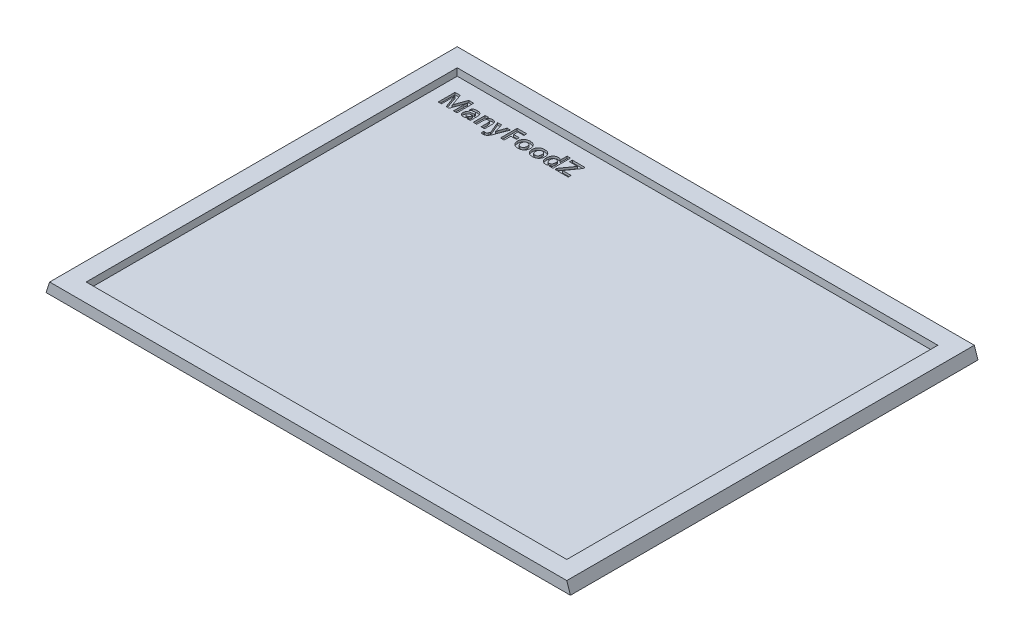
from build123d import *

# Parameters (mm, degrees)
SKETCH1_W           = 143.6
SKETCH1_H           = 111.6
BOSS_EXTRUDE1_DEPTH = 3
CUT_EXTRUDE1_REACH  = 134.736
SKETCH3_W           = 131.6
SKETCH3_H           = 101.6
CUT_EXTRUDE2_DEPTH  = 2
CUT_EXTRUDE3_DEPTH  = 0.6


with BuildPart() as part:
    # Sketch1 → Boss-Extrude1 (new body)
    with BuildSketch(Plane(origin=(0, 0, 0), x_dir=(1, 0, 0), z_dir=(0, 1, 0))):
        Rectangle(SKETCH1_W, SKETCH1_H)
    extrude(amount=BOSS_EXTRUDE1_DEPTH)

    # Sketch2 → Cut-Extrude1 (cut, up to next)
    with BuildSketch(Plane.XY.offset(55.8), mode=Mode.PRIVATE) as cut_extrude1_sk1:
        Polygon((71.8, 0), (70.8, 3), (71.8, 3), align=None)
    cut_extrude1_tool1 = extrude(cut_extrude1_sk1.sketch, amount=-CUT_EXTRUDE1_REACH, mode=Mode.PRIVATE) & part.part
    # Sketch2 → Cut-Extrude1 (cut, up to next)
    with BuildSketch(Plane.XY.offset(55.8), mode=Mode.PRIVATE) as cut_extrude1_sk2:
        Polygon((-71.8, 3), (-71.8, 0), (-70.8, 3), align=None)
    cut_extrude1_tool2 = extrude(cut_extrude1_sk2.sketch, amount=-CUT_EXTRUDE1_REACH, mode=Mode.PRIVATE) & part.part
    add(cut_extrude1_tool1.solids().sort_by_distance((71.466667, 2, 55.8))[0], mode=Mode.SUBTRACT)
    add(cut_extrude1_tool2.solids().sort_by_distance((-71.466667, 2, 55.8))[0], mode=Mode.SUBTRACT)

    # Sketch3 → Cut-Extrude2 (cut)
    with BuildSketch(Plane(origin=(0, 3, 0), x_dir=(1, 0, 0), z_dir=(0, 1, 0))):
        Rectangle(SKETCH3_W, SKETCH3_H)
    extrude(amount=-CUT_EXTRUDE2_DEPTH, mode=Mode.SUBTRACT)

    # Sketch4 → Cut-Extrude3 (cut)
    # profile 1 of 9: a face of its own
    with BuildSketch(Plane(origin=(0, 1, 0), x_dir=(1, 0, 0), z_dir=(0, 1, 0))):
        with BuildLine():
            Line((-58.092627806, 42.07925622), (-58.092627806, 44.857391199))
            add(Edge.make_bspline(
                [(-58.092627806, 44.857391199), (-58.092600808, 44.89058489), (-58.092545367, 44.958748281), (-58.087288699, 45.064112925), (-58.081600875, 45.175656275), (-58.072758527, 45.293579437), (-58.061013133, 45.417538842), (-58.048523348, 45.547808867), (-58.031287835, 45.6839239), (-58.019287266, 45.776744036), (-58.013152709, 45.824192651)],
                knots=[0, 0, 0, 0, 0.820532149, 1.684966374, 2.607606779, 3.581914253, 4.608215301, 5.686044516, 6.81713186, 8, 8, 8, 8], degree=3))
            Line((-58.013152709, 45.824192651), (-58.036733233, 45.824192651))
            add(Edge.make_bspline(
                [(-58.036733233, 45.824192651), (-58.043897275, 45.788943129), (-58.057589414, 45.72157315), (-58.079007763, 45.625373343), (-58.097743072, 45.538154483), (-58.116251169, 45.460165447), (-58.13350413, 45.391099306), (-58.150263696, 45.331251861), (-58.164547911, 45.280311099), (-58.175171819, 45.250066318), (-58.179963077, 45.236426276)],
                knots=[0, 0, 0, 0, 1.426064356, 2.725538406, 3.907327566, 4.962762773, 5.903337351, 6.72936823, 7.426959974, 8, 8, 8, 8], degree=3))
            Line((-58.179963077, 45.236426276), (-59.322308425, 42.07925622))
            Line((-59.322308425, 42.07925622), (-60.104832455, 42.07925622))
            Line((-60.104832455, 42.07925622), (-61.246304451, 45.206732283))
            add(Edge.make_bspline(
                [(-61.246304451, 45.206732283), (-61.250192875, 45.218053211), (-61.259291303, 45.244542771), (-61.271995084, 45.290989588), (-61.286678805, 45.349909508), (-61.304350755, 45.420766106), (-61.322306298, 45.504543051), (-61.343090724, 45.600064875), (-61.367341194, 45.707805353), (-61.382438043, 45.783980105), (-61.390407648, 45.824192651)],
                knots=[0, 0, 0, 0, 0.452786508, 1.059464042, 1.820794487, 2.75042866, 3.822030313, 5.062086147, 6.449079346, 8, 8, 8, 8], degree=3))
            Line((-61.390407648, 45.824192651), (-61.41660823, 45.824192651))
            add(Edge.make_bspline(
                [(-61.41660823, 45.824192651), (-61.408748126, 45.631790347), (-61.393020348, 45.246800442), (-61.391278828, 44.861493306), (-61.390407648, 44.668747013)],
                knots=[0, 0, 0, 0, 0.999518694, 2, 2, 2, 2], degree=3))
            Line((-61.390407648, 44.668747013), (-61.390407648, 42.07925622))
            Line((-61.390407648, 42.07925622), (-62.284720826, 42.07925622))
            Line((-62.284720826, 42.07925622), (-62.284720826, 46.662611255))
            Line((-62.284720826, 46.662611255), (-60.831461912, 46.662611255))
            Line((-60.831461912, 46.662611255), (-59.852433522, 43.892336451))
            add(Edge.make_bspline(
                [(-59.852433522, 43.892336451), (-59.833028262, 43.836015975), (-59.795162297, 43.726116429), (-59.747673013, 43.562179473), (-59.710561947, 43.403272643), (-59.693226196, 43.298270215), (-59.684749801, 43.246928797)],
                knots=[0, 0, 0, 0, 1.070175583, 2.088260221, 3.065246074, 4, 4, 4, 4], degree=3))
            Line((-59.684749801, 43.246928797), (-59.664662688, 43.246928797))
            add(Edge.make_bspline(
                [(-59.664662688, 43.246928797), (-59.64954193, 43.30756333), (-59.620235285, 43.42508354), (-59.572719001, 43.594078858), (-59.526394476, 43.751211602), (-59.49182232, 43.850536736), (-59.47514515, 43.89844992)],
                knots=[0, 0, 0, 0, 1.1046679, 2.14103741, 3.103260037, 4, 4, 4, 4], degree=3))
            Line((-59.47514515, 43.89844992), (-58.483889821, 46.662611255))
            Line((-58.483889821, 46.662611255), (-57.142420055, 46.662611255))
            Line((-57.142420055, 46.662611255), (-57.142420055, 42.07925622))
            Line((-57.142420055, 42.07925622), (-58.092627806, 42.07925622))
        make_face()
    # profile 2 of 9: a face of its own
    with BuildSketch(Plane(origin=(0, 1, 0), x_dir=(1, 0, 0), z_dir=(0, 1, 0))):
        with BuildLine():
            add(Edge.make_bspline(
                [(-56.080423157, 45.101056605), (-56.041156996, 45.121265776), (-55.958266798, 45.163926993), (-55.820129731, 45.216565001), (-55.663564561, 45.261920532), (-55.493993244, 45.301353594), (-55.322457493, 45.334885974), (-55.158572618, 45.35803224), (-55.008285788, 45.374606646), (-54.912207464, 45.376252461), (-54.866462886, 45.377036062)],
                knots=[0, 0, 0, 0, 0.844161796, 1.782011202, 2.821464139, 3.959991635, 5.110977224, 6.163000581, 7.125372316, 8, 8, 8, 8], degree=3))
            add(Edge.make_bspline(
                [(-54.866462886, 45.377036062), (-54.811690529, 45.376103465), (-54.705400683, 45.37429369), (-54.551257978, 45.358258984), (-54.407283822, 45.332802179), (-54.274399131, 45.295014982), (-54.151446067, 45.247950064), (-54.039267591, 45.189620624), (-53.938196346, 45.119612989), (-53.846138463, 45.041139812), (-53.766337486, 44.950297568), (-53.697692341, 44.848467103), (-53.639440373, 44.736449203), (-53.590905641, 44.614263782), (-53.554880212, 44.481097206), (-53.52771726, 44.338093841), (-53.512083861, 44.184091805), (-53.51023046, 44.078104874), (-53.509272771, 44.023339358)],
                knots=[0, 0, 0, 0, 1.195033485, 2.319051647, 3.37828662, 4.38189099, 5.329303812, 6.247200064, 7.133620009, 8.0074276, 8.88063446, 9.763472527, 10.681368779, 11.631100749, 12.62687191, 13.687268524, 14.804966515, 16, 16, 16, 16], degree=3))
            Line((-53.509272771, 44.023339358), (-53.509272771, 42.07925622))
            Line((-53.509272771, 42.07925622), (-54.403585949, 42.07925622))
            Line((-54.403585949, 42.07925622), (-54.403585949, 42.542133158))
            Line((-54.403585949, 42.542133158), (-54.415812887, 42.542133158))
            add(Edge.make_bspline(
                [(-54.415812887, 42.542133158), (-54.444232926, 42.500905148), (-54.499924932, 42.420114599), (-54.59874306, 42.31393815), (-54.706913904, 42.223376154), (-54.825944123, 42.15088617), (-54.954052707, 42.093221904), (-55.091792401, 42.052528959), (-55.239331887, 42.027297754), (-55.34087941, 42.024698281), (-55.393094572, 42.023361647)],
                knots=[0, 0, 0, 0, 1.036379796, 2.030893378, 2.994715684, 3.950597048, 4.909063114, 5.897577251, 6.918946122, 8, 8, 8, 8], degree=3))
            add(Edge.make_bspline(
                [(-55.393094572, 42.023361647), (-55.430962635, 42.024327175), (-55.504832652, 42.026210652), (-55.612743766, 42.037173232), (-55.714654217, 42.057538457), (-55.810898011, 42.08529207), (-55.901816759, 42.121124038), (-55.986286528, 42.166005032), (-56.065922187, 42.217481098), (-56.138183185, 42.278017614), (-56.203476357, 42.34498321), (-56.261108786, 42.417698035), (-56.30823188, 42.497407467), (-56.347728486, 42.582157087), (-56.378322235, 42.672680308), (-56.400111337, 42.768647002), (-56.413448885, 42.870429068), (-56.414996839, 42.940340382), (-56.415790598, 42.976189456)],
                knots=[0, 0, 0, 0, 1.151241264, 2.245750264, 3.292235834, 4.305995761, 5.287015962, 6.256796608, 7.20909936, 8.164234827, 9.11542683, 10.048331367, 10.977113757, 11.923353321, 12.886001939, 13.875605435, 14.910654483, 16, 16, 16, 16], degree=3))
            add(Edge.make_bspline(
                [(-56.415790598, 42.976189456), (-56.414988054, 43.013199465), (-56.41342189, 43.085424424), (-56.400182566, 43.190711703), (-56.378054593, 43.289959388), (-56.348908167, 43.384004329), (-56.309565829, 43.471688001), (-56.260332826, 43.552575378), (-56.205161534, 43.629379066), (-56.138722126, 43.698173007), (-56.064685286, 43.761538175), (-55.982579721, 43.81951746), (-55.89074672, 43.869907456), (-55.790845087, 43.915257892), (-55.682499707, 43.95572884), (-55.564916129, 43.988423097), (-55.43886786, 44.015525571), (-55.351547559, 44.028759279), (-55.306632654, 44.035566296)],
                knots=[0, 0, 0, 0, 1.040433833, 2.030404586, 2.977796283, 3.896860488, 4.794531022, 5.671967209, 6.556098576, 7.447814657, 8.353474551, 9.293695121, 10.268488436, 11.294197642, 12.376862801, 13.517047719, 14.72284492, 16, 16, 16, 16], degree=3))
            Line((-55.306632654, 44.035566296), (-54.41668624, 44.153468912))
            add(Edge.make_bspline(
                [(-54.41668624, 44.153468912), (-54.417977839, 44.196739106), (-54.420426708, 44.278779215), (-54.4488933, 44.393198948), (-54.494146714, 44.491451526), (-54.559860782, 44.571814028), (-54.644576866, 44.633263295), (-54.747388229, 44.67602432), (-54.867506968, 44.702091025), (-54.953654229, 44.704844844), (-54.999212499, 44.706301179)],
                knots=[0, 0, 0, 0, 1.126537193, 2.135909854, 3.053075826, 3.927259428, 4.812815909, 5.755167073, 6.812838579, 8, 8, 8, 8], degree=3))
            add(Edge.make_bspline(
                [(-54.999212499, 44.706301179), (-55.046707563, 44.705298191), (-55.141375261, 44.703299023), (-55.282107703, 44.687062025), (-55.42077666, 44.660856193), (-55.557373976, 44.62396012), (-55.692033053, 44.576862574), (-55.824329723, 44.518627725), (-55.954870936, 44.450952692), (-56.038299841, 44.397780445), (-56.080423157, 44.370933738)],
                knots=[0, 0, 0, 0, 0.992177821, 1.977620056, 2.955883283, 3.938599532, 4.931280679, 5.933698501, 6.95672286, 8, 8, 8, 8], degree=3))
            Line((-56.080423157, 44.370933738), (-56.080423157, 45.101056605))
        make_face()
        with BuildLine():
            add(Edge.make_bspline(
                [(-55.018426258, 43.532515134), (-55.057939782, 43.526547953), (-55.132729657, 43.515253473), (-55.235849992, 43.48360345), (-55.32376629, 43.442897179), (-55.396611299, 43.391876191), (-55.453057852, 43.329450382), (-55.493159757, 43.256863751), (-55.517559041, 43.174227546), (-55.520134816, 43.115808865), (-55.521477421, 43.085358545)],
                knots=[0, 0, 0, 0, 1.281690516, 2.425940907, 3.45032824, 4.381560374, 5.261858999, 6.127999084, 7.024232899, 8, 8, 8, 8], degree=3))
            add(Edge.make_bspline(
                [(-55.521477421, 43.085358545), (-55.52003301, 43.057241466), (-55.517242707, 43.002925105), (-55.4936953, 42.925553547), (-55.45476442, 42.857036051), (-55.400199866, 42.798890491), (-55.333659586, 42.751288855), (-55.254603301, 42.71803681), (-55.16557158, 42.697879734), (-55.102671533, 42.69539103), (-55.069954068, 42.69409653)],
                knots=[0, 0, 0, 0, 1.002064714, 1.935780994, 2.857447314, 3.791452732, 4.76036446, 5.756537646, 6.833062882, 8, 8, 8, 8], degree=3))
            add(Edge.make_bspline(
                [(-55.069954068, 42.69409653), (-55.04664463, 42.69490499), (-55.001028225, 42.696487141), (-54.934153799, 42.70484532), (-54.870739427, 42.720963687), (-54.810178183, 42.742888303), (-54.752510309, 42.770515283), (-54.698639331, 42.805309538), (-54.647851475, 42.845771202), (-54.599888017, 42.891476021), (-54.557676267, 42.943072132), (-54.519999301, 42.997378735), (-54.486937732, 43.054135334), (-54.461918279, 43.115215373), (-54.442023848, 43.178677814), (-54.426786693, 43.244879943), (-54.417939265, 43.314224362), (-54.417109734, 43.361603663), (-54.41668624, 43.385791878)],
                knots=[0, 0, 0, 0, 1.051845881, 2.058454922, 3.033033584, 3.996758545, 4.959946562, 5.910701175, 6.882799539, 7.885804649, 8.892927484, 9.883737812, 10.865895372, 11.848754975, 12.853821056, 13.863679714, 14.909359733, 16, 16, 16, 16], degree=3))
            Line((-54.41668624, 43.385791878), (-54.41668624, 43.610243525))
            Line((-54.41668624, 43.610243525), (-55.018426258, 43.532515134))
        make_face(mode=Mode.SUBTRACT)
    # profile 3 of 9: a face of its own
    with BuildSketch(Plane(origin=(0, 1, 0), x_dir=(1, 0, 0), z_dir=(0, 1, 0))):
        with BuildLine():
            Line((-49.59665262, 42.07925622), (-50.546860371, 42.07925622))
            Line((-50.546860371, 42.07925622), (-50.546860371, 43.871375986))
            add(Edge.make_bspline(
                [(-50.546860371, 43.871375986), (-50.546989091, 43.902837255), (-50.547238546, 43.963807729), (-50.555023777, 44.052041955), (-50.564507844, 44.134512257), (-50.580844029, 44.210451167), (-50.599447388, 44.281166164), (-50.623972642, 44.34530131), (-50.651914718, 44.403676048), (-50.684144541, 44.456031038), (-50.722366864, 44.501217382), (-50.763005696, 44.542141702), (-50.809216564, 44.575568513), (-50.859814835, 44.602820845), (-50.914479477, 44.624864852), (-50.973963683, 44.639118682), (-51.037027608, 44.649534515), (-51.08072289, 44.6501105), (-51.103186049, 44.650406606)],
                knots=[0, 0, 0, 0, 1.385577933, 2.685185481, 3.900730131, 5.040333697, 6.104607026, 7.119499225, 8.0603568, 8.953669725, 9.819198624, 10.662777709, 11.488914802, 12.321203114, 13.190620345, 14.077277699, 15.011554236, 16, 16, 16, 16], degree=3))
            add(Edge.make_bspline(
                [(-51.103186049, 44.650406606), (-51.124765353, 44.649683641), (-51.167553397, 44.648250126), (-51.230185721, 44.638430084), (-51.290171914, 44.623045173), (-51.346921957, 44.599716097), (-51.400957735, 44.569906316), (-51.452665726, 44.534126284), (-51.501177424, 44.491560349), (-51.546283432, 44.442995342), (-51.586620829, 44.389080358), (-51.623421214, 44.332119588), (-51.652453429, 44.270305776), (-51.678314883, 44.205864489), (-51.69754863, 44.137339828), (-51.70997105, 44.065297383), (-51.719539989, 43.990112245), (-51.720272807, 43.938656802), (-51.720646416, 43.912423564)],
                knots=[0, 0, 0, 0, 0.962967614, 1.90939895, 2.82343066, 3.721059163, 4.639881235, 5.573469571, 6.522039335, 7.515047549, 8.526002385, 9.52460601, 10.535811341, 11.568577159, 12.621661098, 13.704858409, 14.829880903, 16, 16, 16, 16], degree=3))
            Line((-51.720646416, 43.912423564), (-51.720646416, 42.07925622))
            Line((-51.720646416, 42.07925622), (-52.670854167, 42.07925622))
            Line((-52.670854167, 42.07925622), (-52.670854167, 45.321141489))
            Line((-52.670854167, 45.321141489), (-51.720646416, 45.321141489))
            Line((-51.720646416, 45.321141489), (-51.720646416, 44.783156218))
            Line((-51.720646416, 44.783156218), (-51.709292831, 44.783156218))
            add(Edge.make_bspline(
                [(-51.709292831, 44.783156218), (-51.679212792, 44.83019799), (-51.620413468, 44.922153468), (-51.516164183, 45.044376476), (-51.400117823, 45.146744765), (-51.27468758, 45.231939042), (-51.137596604, 45.296312604), (-50.99125042, 45.344685635), (-50.833698106, 45.371248477), (-50.725407842, 45.375077178), (-50.670003103, 45.377036062)],
                knots=[0, 0, 0, 0, 1.064617132, 2.081073364, 3.053068974, 4.009833717, 4.963950105, 5.933641332, 6.942785272, 8, 8, 8, 8], degree=3))
            add(Edge.make_bspline(
                [(-50.670003103, 45.377036062), (-50.626567106, 45.376134558), (-50.542305026, 45.374385716), (-50.420226407, 45.357895967), (-50.30597008, 45.333634745), (-50.200792543, 45.296328765), (-50.103237355, 45.25015092), (-50.014938519, 45.192056122), (-49.934493803, 45.124114222), (-49.862466017, 45.045899915), (-49.799215003, 44.956931623), (-49.745444938, 44.857446543), (-49.69847758, 44.748346413), (-49.661840764, 44.628365327), (-49.631731505, 44.498295573), (-49.611400958, 44.357785834), (-49.599171659, 44.20696222), (-49.597510157, 44.103129993), (-49.59665262, 44.04953994)],
                knots=[0, 0, 0, 0, 1.067420533, 2.070703575, 3.024128503, 3.934192378, 4.808213066, 5.671854353, 6.525140104, 7.391387901, 8.279251406, 9.20186848, 10.167150257, 11.194978914, 12.281972813, 13.447160288, 14.682424336, 16, 16, 16, 16], degree=3))
            Line((-49.59665262, 44.04953994), (-49.59665262, 42.07925622))
        make_face()
    # profile 4 of 9: a face of its own
    with BuildSketch(Plane(origin=(0, 1, 0), x_dir=(1, 0, 0), z_dir=(0, 1, 0))):
        with BuildLine():
            Line((-45.725953398, 45.321141489), (-47.081396808, 41.798036647))
            add(Edge.make_bspline(
                [(-47.081396808, 41.798036647), (-47.101284046, 41.748337913), (-47.140285976, 41.650871052), (-47.205736686, 41.511582437), (-47.274872584, 41.381902347), (-47.347119783, 41.261619134), (-47.424447198, 41.15149768), (-47.504207105, 41.049942534), (-47.588426017, 40.958641899), (-47.676260651, 40.877221935), (-47.766781458, 40.803815158), (-47.862848326, 40.74218176), (-47.96129042, 40.688047853), (-48.064417208, 40.64571972), (-48.17039119, 40.610633987), (-48.280950326, 40.588060567), (-48.394740571, 40.572021192), (-48.472006956, 40.570747002), (-48.511075198, 40.570102733)],
                knots=[0, 0, 0, 0, 1.274545313, 2.499579345, 3.662627125, 4.773100961, 5.838560291, 6.864961619, 7.846165112, 8.792891985, 9.715346361, 10.61717241, 11.507412726, 12.386789422, 13.268131451, 14.161470608, 15.070383442, 16, 16, 16, 16], degree=3))
            add(Edge.make_bspline(
                [(-48.511075198, 40.570102733), (-48.570203258, 40.571152388), (-48.681653887, 40.573130885), (-48.838207359, 40.586385827), (-48.974209078, 40.609618015), (-49.055669503, 40.63509462), (-49.093601457, 40.646957772)],
                knots=[0, 0, 0, 0, 1.202193107, 2.266016832, 3.192572723, 4, 4, 4, 4], degree=3))
            Line((-49.093601457, 40.646957772), (-49.093601457, 41.408521337))
            add(Edge.make_bspline(
                [(-49.093601457, 41.408521337), (-49.060541177, 41.391260222), (-48.994787384, 41.356929483), (-48.888415681, 41.322399992), (-48.77747965, 41.300539057), (-48.701571861, 41.298013995), (-48.66303857, 41.29673219)],
                knots=[0, 0, 0, 0, 0.993652693, 1.976281932, 2.972694144, 4, 4, 4, 4], degree=3))
            add(Edge.make_bspline(
                [(-48.66303857, 41.29673219), (-48.630930682, 41.297882951), (-48.56883014, 41.300108663), (-48.479648555, 41.317873966), (-48.397663996, 41.346959895), (-48.322662659, 41.38811245), (-48.255989494, 41.442259501), (-48.19650807, 41.507225744), (-48.144430949, 41.584045459), (-48.117289358, 41.641576894), (-48.103219482, 41.671400504)],
                knots=[0, 0, 0, 0, 1.071610233, 2.072623892, 3.022870821, 3.967180676, 4.914638322, 5.877975009, 6.899967548, 8, 8, 8, 8], degree=3))
            Line((-48.103219482, 41.671400504), (-47.919815412, 42.094976569))
            Line((-47.919815412, 42.094976569), (-49.261285178, 45.321141489))
            Line((-49.261285178, 45.321141489), (-48.187934695, 45.321141489))
            Line((-48.187934695, 45.321141489), (-47.539906982, 43.301950018))
            add(Edge.make_bspline(
                [(-47.539906982, 43.301950018), (-47.530240343, 43.27031551), (-47.510604678, 43.206056924), (-47.487161969, 43.105704305), (-47.468102532, 43.000121051), (-47.45839893, 42.92761603), (-47.453445064, 42.89060089)],
                knots=[0, 0, 0, 0, 0.942726539, 1.914942855, 2.935540168, 4, 4, 4, 4], degree=3))
            Line((-47.453445064, 42.89060089), (-47.435104657, 42.89060089))
            add(Edge.make_bspline(
                [(-47.435104657, 42.89060089), (-47.430697659, 42.918301958), (-47.421140312, 42.978376569), (-47.40012034, 43.073775094), (-47.370330535, 43.180846709), (-47.348169139, 43.255986183), (-47.3364158, 43.295836549)],
                knots=[0, 0, 0, 0, 0.806124642, 1.748222305, 2.805765358, 4, 4, 4, 4], degree=3))
            Line((-47.3364158, 43.295836549), (-46.676161149, 45.321141489))
            Line((-46.676161149, 45.321141489), (-45.725953398, 45.321141489))
        make_face()
    # profile 5 of 9: a face of its own
    with BuildSketch(Plane(origin=(0, 1, 0), x_dir=(1, 0, 0), z_dir=(0, 1, 0))):
        Polygon((-42.609830921, 45.880087225), (-44.255227431, 45.880087225), (-44.255227431, 44.706301179), (-42.721620068, 44.706301179), (-42.721620068, 43.923777149), (-44.230773555, 43.923777149), (-44.230773555, 42.07925622), (-45.236875879, 42.07925622), (-45.236875879, 46.662611255), (-42.609830921, 46.662611255), align=None)
    # profile 6 of 9: a face of its own
    with BuildSketch(Plane(origin=(0, 1, 0), x_dir=(1, 0, 0), z_dir=(0, 1, 0))):
        with BuildLine():
            add(Edge.make_bspline(
                [(-42.162674332, 43.685351858), (-42.161176627, 43.749467351), (-42.158253083, 43.874621817), (-42.135180895, 44.056756898), (-42.097849251, 44.228550625), (-42.044976357, 44.389912018), (-41.974842487, 44.540075501), (-41.892298953, 44.680982636), (-41.792465619, 44.81028157), (-41.677954912, 44.927708297), (-41.551350758, 45.033558137), (-41.413409783, 45.125698904), (-41.264750139, 45.203900864), (-41.105765178, 45.26747439), (-40.936247338, 45.316310396), (-40.756965135, 45.352196754), (-40.566687004, 45.373198764), (-40.436399624, 45.375736515), (-40.369681213, 45.377036062)],
                knots=[0, 0, 0, 0, 1.103453058, 2.15395801, 3.154678934, 4.126148344, 5.070148626, 6.002678962, 6.931877209, 7.874599583, 8.821044363, 9.767595283, 10.724805658, 11.707533345, 12.709834137, 13.757538153, 14.851665509, 16, 16, 16, 16], degree=3))
            add(Edge.make_bspline(
                [(-40.369681213, 45.377036062), (-40.304986352, 45.375798365), (-40.178735242, 45.373383015), (-39.994830587, 45.351572277), (-39.820856934, 45.318612327), (-39.657748306, 45.268818157), (-39.503765981, 45.207515457), (-39.36108191, 45.129849771), (-39.228052046, 45.039704089), (-39.106981626, 44.935528491), (-38.997330794, 44.820302), (-38.902064498, 44.694191623), (-38.820898476, 44.558761538), (-38.755209292, 44.41328102), (-38.703686226, 44.258463673), (-38.667195718, 44.094017375), (-38.644890453, 43.920318948), (-38.642526089, 43.801285134), (-38.641316195, 43.740373079)],
                knots=[0, 0, 0, 0, 1.154217571, 2.252439331, 3.300975582, 4.310246632, 5.291497618, 6.253956641, 7.203666926, 8.154399993, 9.098965462, 10.037337181, 10.969401587, 11.911118977, 12.880523217, 13.876343809, 14.913281367, 16, 16, 16, 16], degree=3))
            add(Edge.make_bspline(
                [(-38.641316195, 43.740373079), (-38.6429256, 43.676560996), (-38.646073274, 43.551757283), (-38.667720835, 43.369500221), (-38.705388407, 43.197277771), (-38.757894879, 43.034869843), (-38.824932518, 42.881867337), (-38.9086862, 42.740022455), (-39.006227482, 42.607533472), (-39.118949533, 42.48683302), (-39.243508405, 42.377416429), (-39.380136701, 42.282421337), (-39.527179172, 42.202101557), (-39.684838824, 42.135943262), (-39.853084989, 42.085928215), (-40.031533503, 42.049033619), (-40.220654754, 42.026968965), (-40.350407973, 42.02458318), (-40.41684226, 42.023361647)],
                knots=[0, 0, 0, 0, 1.09727435, 2.146049842, 3.15059286, 4.124223328, 5.076775921, 6.016934818, 6.951103508, 7.900454057, 8.851281785, 9.797022045, 10.755907445, 11.727489397, 12.731570765, 13.76934414, 14.857893218, 16, 16, 16, 16], degree=3))
            add(Edge.make_bspline(
                [(-40.41684226, 42.023361647), (-40.482111899, 42.024631728), (-40.609509561, 42.027110756), (-40.795306125, 42.048489575), (-40.970732745, 42.083031758), (-41.135993003, 42.132084188), (-41.290784087, 42.194867536), (-41.435693361, 42.271316308), (-41.569734425, 42.362554965), (-41.69286717, 42.467499701), (-41.803780421, 42.583920936), (-41.899731167, 42.711986442), (-41.98128729, 42.84954936), (-42.048066033, 42.997444856), (-42.099574468, 43.15534764), (-42.135711521, 43.323354631), (-42.159388286, 43.500982311), (-42.161562558, 43.622973799), (-42.162674332, 43.685351858)],
                knots=[0, 0, 0, 0, 1.149013187, 2.242721024, 3.288275975, 4.293858527, 5.273402544, 6.22507903, 7.173436187, 8.122568892, 9.068984397, 9.998887601, 10.934313246, 11.879547946, 12.850577541, 13.85308481, 14.902215176, 16, 16, 16, 16], degree=3))
        make_face()
        with BuildLine():
            add(Edge.make_bspline(
                [(-41.212466581, 43.697578796), (-41.211781325, 43.659419036), (-41.210450394, 43.585303646), (-41.20060775, 43.477682386), (-41.185563456, 43.37709009), (-41.162664057, 43.284269928), (-41.13412742, 43.198624895), (-41.097987363, 43.120685238), (-41.056387667, 43.049248567), (-41.00710469, 42.986044299), (-40.951492036, 42.930519779), (-40.889772007, 42.881934094), (-40.821454986, 42.840764048), (-40.746453431, 42.8077531), (-40.665535409, 42.781086068), (-40.577851351, 42.763493759), (-40.483837917, 42.751537568), (-40.418920822, 42.750517701), (-40.385401562, 42.749991103)],
                knots=[0, 0, 0, 0, 1.270888468, 2.468369665, 3.597092737, 4.655434961, 5.64897887, 6.599178008, 7.512182997, 8.396678124, 9.260629555, 10.123873252, 11.006932034, 11.909787606, 12.848136796, 13.838979758, 14.884179917, 16, 16, 16, 16], degree=3))
            add(Edge.make_bspline(
                [(-40.385401562, 42.749991103), (-40.353342739, 42.750553558), (-40.291047031, 42.751646502), (-40.200660158, 42.76320229), (-40.116295463, 42.78218075), (-40.038403278, 42.809250864), (-39.966518841, 42.843679051), (-39.901005905, 42.88548689), (-39.841317308, 42.935284716), (-39.788577689, 42.99280497), (-39.741275387, 43.057621688), (-39.701360595, 43.130601601), (-39.667470909, 43.211167318), (-39.639607635, 43.298893872), (-39.617775982, 43.394105105), (-39.602173831, 43.496845338), (-39.593851305, 43.607486681), (-39.592316682, 43.683592351), (-39.591523946, 43.722906025)],
                knots=[0, 0, 0, 0, 1.070965572, 2.081066958, 3.039323393, 3.956285232, 4.830977526, 5.697350879, 6.546953418, 7.421375102, 8.299092527, 9.222381685, 10.194613687, 11.216177451, 12.294761889, 13.456137845, 14.68592486, 16, 16, 16, 16], degree=3))
            add(Edge.make_bspline(
                [(-39.591523946, 43.722906025), (-39.592318116, 43.76047304), (-39.593853253, 43.833090399), (-39.602124732, 43.938517243), (-39.617956572, 44.036569368), (-39.639518031, 44.127468653), (-39.667217051, 44.211390474), (-39.702603153, 44.287358667), (-39.742548889, 44.357360996), (-39.789853126, 44.419577188), (-39.843773575, 44.474168371), (-39.903299699, 44.521902372), (-39.96989192, 44.561018764), (-40.041762057, 44.594878479), (-40.12053756, 44.619844738), (-40.205510731, 44.636837995), (-40.296270992, 44.648861305), (-40.359158894, 44.649881639), (-40.391515031, 44.650406606)],
                knots=[0, 0, 0, 0, 1.285280532, 2.484458215, 3.614137234, 4.679338145, 5.677637889, 6.631225331, 7.541609585, 8.429939353, 9.296111078, 10.160850403, 11.031874669, 11.931905529, 12.873562193, 13.850117319, 14.893874718, 16, 16, 16, 16], degree=3))
            add(Edge.make_bspline(
                [(-40.391515031, 44.650406606), (-40.423005079, 44.649940382), (-40.484493991, 44.649030012), (-40.573852052, 44.63598039), (-40.658234392, 44.617240443), (-40.73718765, 44.590284294), (-40.810518337, 44.554699094), (-40.878896942, 44.512183361), (-40.941379013, 44.46079945), (-40.998173275, 44.402180099), (-41.048929658, 44.336601155), (-41.092765304, 44.264082021), (-41.130603743, 44.185634345), (-41.159831935, 44.100084935), (-41.183460244, 44.008706309), (-41.201127392, 43.910974439), (-41.210306126, 43.806343097), (-41.211731866, 43.734566711), (-41.212466581, 43.697578796)],
                knots=[0, 0, 0, 0, 1.057503077, 2.064929068, 3.028638446, 3.96006429, 4.861611523, 5.762946329, 6.660021997, 7.573438799, 8.50115664, 9.440922936, 10.416923198, 11.42268461, 12.474058499, 13.587313027, 14.756690526, 16, 16, 16, 16], degree=3))
        make_face(mode=Mode.SUBTRACT)
    # profile 7 of 9: a face of its own
    with BuildSketch(Plane(origin=(0, 1, 0), x_dir=(1, 0, 0), z_dir=(0, 1, 0))):
        with BuildLine():
            add(Edge.make_bspline(
                [(-38.194159607, 43.685351858), (-38.192661902, 43.749467351), (-38.189738358, 43.874621817), (-38.16666617, 44.056756898), (-38.129334526, 44.228550625), (-38.076461631, 44.389912018), (-38.006327762, 44.540075501), (-37.923784228, 44.680982636), (-37.823950894, 44.81028157), (-37.709440187, 44.927708297), (-37.582836032, 45.033558137), (-37.444895058, 45.125698904), (-37.296235414, 45.203900864), (-37.137250453, 45.26747439), (-36.967732613, 45.316310396), (-36.78845041, 45.352196754), (-36.598172278, 45.373198764), (-36.467884899, 45.375736515), (-36.401166488, 45.377036062)],
                knots=[0, 0, 0, 0, 1.103453058, 2.15395801, 3.154678934, 4.126148344, 5.070148626, 6.002678962, 6.931877209, 7.874599583, 8.821044363, 9.767595283, 10.724805658, 11.707533345, 12.709834137, 13.757538153, 14.851665509, 16, 16, 16, 16], degree=3))
            add(Edge.make_bspline(
                [(-36.401166488, 45.377036062), (-36.336471627, 45.375798365), (-36.210220517, 45.373383015), (-36.026315862, 45.351572277), (-35.852342208, 45.318612327), (-35.689233581, 45.268818157), (-35.535251256, 45.207515457), (-35.392567185, 45.129849771), (-35.259537321, 45.039704089), (-35.138466901, 44.935528491), (-35.028816069, 44.820302), (-34.933549773, 44.694191623), (-34.852383751, 44.558761538), (-34.786694566, 44.41328102), (-34.735171501, 44.258463673), (-34.698680993, 44.094017375), (-34.676375728, 43.920318948), (-34.674011364, 43.801285134), (-34.67280147, 43.740373079)],
                knots=[0, 0, 0, 0, 1.154217571, 2.252439331, 3.300975582, 4.310246632, 5.291497618, 6.253956641, 7.203666926, 8.154399993, 9.098965462, 10.037337181, 10.969401587, 11.911118977, 12.880523217, 13.876343809, 14.913281367, 16, 16, 16, 16], degree=3))
            add(Edge.make_bspline(
                [(-34.67280147, 43.740373079), (-34.674410875, 43.676560996), (-34.677558549, 43.551757283), (-34.699206109, 43.369500221), (-34.736873681, 43.197277771), (-34.789380153, 43.034869843), (-34.856417793, 42.881867337), (-34.940171475, 42.740022455), (-35.037712757, 42.607533472), (-35.150434807, 42.48683302), (-35.274993679, 42.377416429), (-35.411621976, 42.282421337), (-35.558664447, 42.202101557), (-35.716324099, 42.135943262), (-35.884570264, 42.085928215), (-36.063018778, 42.049033619), (-36.252140029, 42.026968965), (-36.381893248, 42.02458318), (-36.448327534, 42.023361647)],
                knots=[0, 0, 0, 0, 1.09727435, 2.146049842, 3.15059286, 4.124223328, 5.076775921, 6.016934818, 6.951103508, 7.900454057, 8.851281785, 9.797022045, 10.755907445, 11.727489397, 12.731570765, 13.76934414, 14.857893218, 16, 16, 16, 16], degree=3))
            add(Edge.make_bspline(
                [(-36.448327534, 42.023361647), (-36.513597174, 42.024631728), (-36.640994836, 42.027110756), (-36.8267914, 42.048489575), (-37.002218019, 42.083031758), (-37.167478278, 42.132084188), (-37.322269362, 42.194867536), (-37.467178636, 42.271316308), (-37.6012197, 42.362554965), (-37.724352445, 42.467499701), (-37.835265696, 42.583920936), (-37.931216442, 42.711986442), (-38.012772565, 42.84954936), (-38.079551308, 42.997444856), (-38.131059742, 43.15534764), (-38.167196796, 43.323354631), (-38.190873561, 43.500982311), (-38.193047833, 43.622973799), (-38.194159607, 43.685351858)],
                knots=[0, 0, 0, 0, 1.149013187, 2.242721024, 3.288275975, 4.293858527, 5.273402544, 6.22507903, 7.173436187, 8.122568892, 9.068984397, 9.998887601, 10.934313246, 11.879547946, 12.850577541, 13.85308481, 14.902215176, 16, 16, 16, 16], degree=3))
        make_face()
        with BuildLine():
            add(Edge.make_bspline(
                [(-37.243951855, 43.697578796), (-37.2432666, 43.659419036), (-37.241935669, 43.585303646), (-37.232093025, 43.477682386), (-37.217048731, 43.37709009), (-37.194149331, 43.284269928), (-37.165612695, 43.198624895), (-37.129472637, 43.120685238), (-37.087872942, 43.049248567), (-37.038589965, 42.986044299), (-36.98297731, 42.930519779), (-36.921257282, 42.881934094), (-36.85294026, 42.840764048), (-36.777938705, 42.8077531), (-36.697020684, 42.781086068), (-36.609336626, 42.763493759), (-36.515323192, 42.751537568), (-36.450406097, 42.750517701), (-36.416886837, 42.749991103)],
                knots=[0, 0, 0, 0, 1.270888468, 2.468369665, 3.597092737, 4.655434961, 5.64897887, 6.599178008, 7.512182997, 8.396678124, 9.260629555, 10.123873252, 11.006932034, 11.909787606, 12.848136796, 13.838979758, 14.884179917, 16, 16, 16, 16], degree=3))
            add(Edge.make_bspline(
                [(-36.416886837, 42.749991103), (-36.384828013, 42.750553558), (-36.322532306, 42.751646502), (-36.232145432, 42.76320229), (-36.147780738, 42.78218075), (-36.069888552, 42.809250864), (-35.998004116, 42.843679051), (-35.93249118, 42.88548689), (-35.872802583, 42.935284716), (-35.820062964, 42.99280497), (-35.772760661, 43.057621688), (-35.73284587, 43.130601601), (-35.698956184, 43.211167318), (-35.67109291, 43.298893872), (-35.649261257, 43.394105105), (-35.633659106, 43.496845338), (-35.62533658, 43.607486681), (-35.623801957, 43.683592351), (-35.623009221, 43.722906025)],
                knots=[0, 0, 0, 0, 1.070965572, 2.081066958, 3.039323393, 3.956285232, 4.830977526, 5.697350879, 6.546953418, 7.421375102, 8.299092527, 9.222381685, 10.194613687, 11.216177451, 12.294761889, 13.456137845, 14.68592486, 16, 16, 16, 16], degree=3))
            add(Edge.make_bspline(
                [(-35.623009221, 43.722906025), (-35.623803391, 43.76047304), (-35.625338528, 43.833090399), (-35.633610007, 43.938517243), (-35.649441847, 44.036569368), (-35.671003305, 44.127468653), (-35.698702325, 44.211390474), (-35.734088428, 44.287358667), (-35.774034163, 44.357360996), (-35.8213384, 44.419577188), (-35.87525885, 44.474168371), (-35.934784974, 44.521902372), (-36.001377195, 44.561018764), (-36.073247332, 44.594878479), (-36.152022835, 44.619844738), (-36.236996006, 44.636837995), (-36.327756266, 44.648861305), (-36.390644169, 44.649881639), (-36.423000306, 44.650406606)],
                knots=[0, 0, 0, 0, 1.285280532, 2.484458215, 3.614137234, 4.679338145, 5.677637889, 6.631225331, 7.541609585, 8.429939353, 9.296111078, 10.160850403, 11.031874669, 11.931905529, 12.873562193, 13.850117319, 14.893874718, 16, 16, 16, 16], degree=3))
            add(Edge.make_bspline(
                [(-36.423000306, 44.650406606), (-36.454490353, 44.649940382), (-36.515979266, 44.649030012), (-36.605337327, 44.63598039), (-36.689719666, 44.617240443), (-36.768672925, 44.590284294), (-36.842003612, 44.554699094), (-36.910382217, 44.512183361), (-36.972864288, 44.46079945), (-37.02965855, 44.402180099), (-37.080414933, 44.336601155), (-37.124250579, 44.264082021), (-37.162089018, 44.185634345), (-37.19131721, 44.100084935), (-37.214945519, 44.008706309), (-37.232612667, 43.910974439), (-37.241791401, 43.806343097), (-37.243217141, 43.734566711), (-37.243951855, 43.697578796)],
                knots=[0, 0, 0, 0, 1.057503077, 2.064929068, 3.028638446, 3.96006429, 4.861611523, 5.762946329, 6.660021997, 7.573438799, 8.50115664, 9.440922936, 10.416923198, 11.42268461, 12.474058499, 13.587313027, 14.756690526, 16, 16, 16, 16], degree=3))
        make_face(mode=Mode.SUBTRACT)
    # profile 8 of 9: a face of its own
    with BuildSketch(Plane(origin=(0, 1, 0), x_dir=(1, 0, 0), z_dir=(0, 1, 0))):
        with BuildLine():
            Line((-30.871970466, 42.07925622), (-31.822178217, 42.07925622))
            Line((-31.822178217, 42.07925622), (-31.822178217, 42.558726859))
            Line((-31.822178217, 42.558726859), (-31.837025213, 42.558726859))
            add(Edge.make_bspline(
                [(-31.837025213, 42.558726859), (-31.866476212, 42.515923939), (-31.924100536, 42.43217502), (-32.028276751, 42.323305617), (-32.141027598, 42.229482335), (-32.265723776, 42.153834669), (-32.400330502, 42.095155635), (-32.545197528, 42.052782364), (-32.700539839, 42.02857919), (-32.807527743, 42.025129196), (-32.862341297, 42.023361647)],
                knots=[0, 0, 0, 0, 1.028519169, 2.012418057, 2.97599927, 3.929154441, 4.893098522, 5.879279751, 6.913482639, 8, 8, 8, 8], degree=3))
            add(Edge.make_bspline(
                [(-32.862341297, 42.023361647), (-32.913064423, 42.024715424), (-33.012589304, 42.027371698), (-33.157704734, 42.047830013), (-33.295177673, 42.080709705), (-33.424504309, 42.128073552), (-33.545249871, 42.189565534), (-33.658459345, 42.263750629), (-33.763736139, 42.351297192), (-33.859401398, 42.453024854), (-33.945861093, 42.565586386), (-34.021369706, 42.688373109), (-34.084541233, 42.821421682), (-34.135402428, 42.964162013), (-34.177158736, 43.116073932), (-34.205438059, 43.278064809), (-34.221893883, 43.449785656), (-34.224373682, 43.567412477), (-34.225644881, 43.627710579)],
                knots=[0, 0, 0, 0, 1.024000001, 2.009211298, 2.953127901, 3.873782394, 4.78346632, 5.683525307, 6.601830589, 7.541637444, 8.497596561, 9.463518162, 10.446973914, 11.466068295, 12.519973604, 13.624727712, 14.782383033, 16, 16, 16, 16], degree=3))
            add(Edge.make_bspline(
                [(-34.225644881, 43.627710579), (-34.224698457, 43.691818219), (-34.22284796, 43.817164795), (-34.201755628, 44.000137213), (-34.170157036, 44.173788244), (-34.124652485, 44.337807432), (-34.066183208, 44.492343662), (-33.994103856, 44.636897727), (-33.910182247, 44.772689796), (-33.812352735, 44.896889282), (-33.704590724, 45.009472817), (-33.587822183, 45.10791455), (-33.463368301, 45.191758902), (-33.330125301, 45.258985696), (-33.189900452, 45.312965877), (-33.040972784, 45.350455006), (-32.884240514, 45.372232885), (-32.777112199, 45.375416318), (-32.722604863, 45.377036062)],
                knots=[0, 0, 0, 0, 1.186460047, 2.3198281, 3.40557668, 4.451803411, 5.466907767, 6.460079162, 7.438261378, 8.417349119, 9.381846444, 10.319087558, 11.240004192, 12.153651381, 13.076647975, 14.016628638, 14.990852333, 16, 16, 16, 16], degree=3))
            add(Edge.make_bspline(
                [(-32.722604863, 45.377036062), (-32.67098601, 45.375890996), (-32.571036348, 45.373673804), (-32.427625378, 45.351155609), (-32.295593685, 45.316849436), (-32.175704194, 45.266958524), (-32.067954233, 45.201807962), (-31.972790395, 45.121931296), (-31.888155151, 45.029234197), (-31.84435033, 44.957469927), (-31.822178217, 44.921145947)],
                knots=[0, 0, 0, 0, 1.165358401, 2.256485159, 3.271192268, 4.241082995, 5.179578049, 6.104234755, 7.040445324, 8, 8, 8, 8], degree=3))
            Line((-31.822178217, 44.921145947), (-31.807331221, 44.921145947))
            Line((-31.807331221, 44.921145947), (-31.807331221, 46.886189549))
            Line((-31.807331221, 46.886189549), (-30.871970466, 46.886189549))
            Line((-30.871970466, 46.886189549), (-30.871970466, 42.07925622))
        make_face()
        with BuildLine():
            add(Edge.make_bspline(
                [(-31.822178217, 43.908930153), (-31.822990331, 43.935147765), (-31.824582923, 43.986561683), (-31.832929237, 44.062117533), (-31.849006527, 44.133929783), (-31.870474984, 44.202674171), (-31.899919543, 44.267145696), (-31.933728705, 44.329135955), (-31.975259073, 44.386742142), (-32.022063155, 44.440508058), (-32.073457413, 44.489463497), (-32.128650741, 44.532162697), (-32.186442589, 44.569468545), (-32.247813973, 44.599130622), (-32.312321498, 44.621908473), (-32.37982194, 44.638717503), (-32.450722738, 44.648210465), (-32.498999678, 44.649667671), (-32.523480445, 44.650406606)],
                knots=[0, 0, 0, 0, 1.103035594, 2.16310255, 3.191003946, 4.193880328, 5.185935609, 6.167050445, 7.159105725, 8.165786688, 9.161763151, 10.138973875, 11.096816631, 12.049637896, 12.998438634, 13.969493638, 14.970349976, 16, 16, 16, 16], degree=3))
            add(Edge.make_bspline(
                [(-32.523480445, 44.650406606), (-32.552053721, 44.649539647), (-32.607724445, 44.647850508), (-32.688941045, 44.635496239), (-32.765531584, 44.614568436), (-32.837292278, 44.584703248), (-32.904655154, 44.546846101), (-32.966688212, 44.499974348), (-33.025002063, 44.445740219), (-33.076889322, 44.382351203), (-33.124394573, 44.312842209), (-33.163948375, 44.236076826), (-33.199632267, 44.154780793), (-33.227309103, 44.06654013), (-33.248818934, 43.972469436), (-33.26473478, 43.87271025), (-33.273098167, 43.767007521), (-33.274641643, 43.694680802), (-33.27543713, 43.657404572)],
                knots=[0, 0, 0, 0, 0.977417041, 1.904349861, 2.803298455, 3.687502346, 4.557281986, 5.439801143, 6.341779755, 7.275325227, 8.236725084, 9.216980219, 10.22537377, 11.271198521, 12.37539812, 13.524984013, 14.724409614, 16, 16, 16, 16], degree=3))
            add(Edge.make_bspline(
                [(-33.27543713, 43.657404572), (-33.275138374, 43.622149752), (-33.274556925, 43.553535632), (-33.264175624, 43.453855384), (-33.250076622, 43.360309023), (-33.228787341, 43.273027953), (-33.202230856, 43.191836076), (-33.168499577, 43.116833204), (-33.129636504, 43.047662765), (-33.08393878, 42.985443825), (-33.033139386, 42.93019058), (-32.977741792, 42.881985354), (-32.91837274, 42.839904102), (-32.852825731, 42.808540478), (-32.784332754, 42.781188253), (-32.710206903, 42.763535097), (-32.631871967, 42.751659892), (-32.577966261, 42.750553646), (-32.550554379, 42.749991103)],
                knots=[0, 0, 0, 0, 1.286199939, 2.503245767, 3.654541049, 4.737035255, 5.778756128, 6.768161295, 7.73429531, 8.66948645, 9.579463658, 10.468158146, 11.346564326, 12.225741489, 13.113800424, 14.033897028, 15.000206348, 16, 16, 16, 16], degree=3))
            add(Edge.make_bspline(
                [(-32.550554379, 42.749991103), (-32.524585417, 42.750469698), (-32.473505825, 42.751411068), (-32.398981357, 42.764577105), (-32.327629408, 42.783362319), (-32.259952591, 42.810788789), (-32.195839094, 42.845660249), (-32.135942797, 42.889396711), (-32.079007697, 42.940119537), (-32.026077, 42.998411404), (-31.978396358, 43.062933852), (-31.935850746, 43.132150701), (-31.901245516, 43.206845322), (-31.872383625, 43.285726553), (-31.849304778, 43.369176276), (-31.834165911, 43.457549809), (-31.824242897, 43.550339991), (-31.822875871, 43.613710295), (-31.822178217, 43.646050986)],
                knots=[0, 0, 0, 0, 0.9630537, 1.894276348, 2.801601212, 3.698889347, 4.598713393, 5.504749443, 6.446453823, 7.425930033, 8.422613656, 9.421873297, 10.437372697, 11.473603361, 12.53831148, 13.647316128, 14.799320499, 16, 16, 16, 16], degree=3))
            Line((-31.822178217, 43.646050986), (-31.822178217, 43.908930153))
        make_face(mode=Mode.SUBTRACT)
    # profile 9 of 9: a face of its own
    with BuildSketch(Plane(origin=(0, 1, 0), x_dir=(1, 0, 0), z_dir=(0, 1, 0))):
        Polygon((-26.679877446, 46.159560093), (-29.002122308, 42.861780251), (-26.679877446, 42.861780251), (-26.679877446, 42.07925622), (-30.31302473, 42.07925622), (-30.31302473, 42.582307383), (-27.94973229, 45.880087225), (-30.145341009, 45.880087225), (-30.145341009, 46.662611255), (-26.679877446, 46.662611255), align=None)
    extrude(amount=-CUT_EXTRUDE3_DEPTH, mode=Mode.SUBTRACT)


solid = part.part
